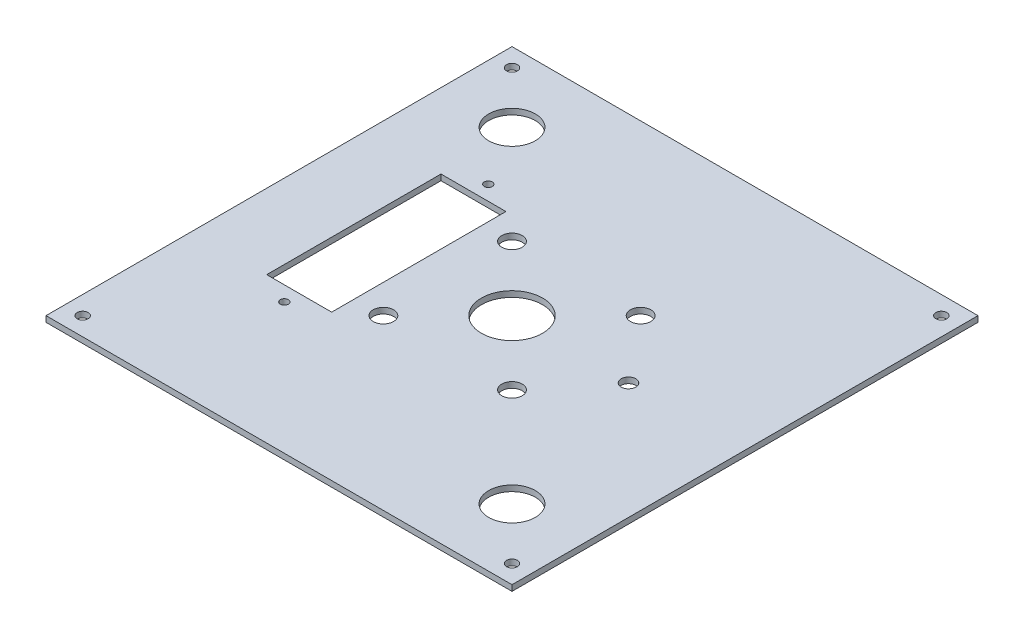
from build123d import *

# Parameters (mm, degrees)
SKETCH1_W           = 254
SKETCH1_H           = 254
BOSS_EXTRUDE1_DEPTH = 3.175
SKETCH5_W           = 35.405687869
SKETCH5_H           = 94.996
CUT_EXTRUDE4_DEPTH  = 25.4
SKETCH2_R           = 2.97688
CUT_EXTRUDE1_DEPTH  = 3.175
SKETCH3_R           = 5.55625
CUT_EXTRUDE3_DEPTH  = 3.175
SKETCH6_R           = 12.7
CUT_EXTRUDE5_DEPTH  = 3.175
SKETCH7_R           = 16.66875
CUT_EXTRUDE6_DEPTH  = 508
SKETCH8_R           = 2.1844
CUT_EXTRUDE7_DEPTH  = 3.175
SKETCH9_R           = 3.96875
CUT_EXTRUDE8_DEPTH  = 3.175


with BuildPart() as part:
    # Sketch1 → Boss-Extrude1 (new body)
    with BuildSketch(Plane(origin=(0, 0, 0), x_dir=(1, 0, 0), z_dir=(0, 1, 0))):
        Rectangle(SKETCH1_W, SKETCH1_H)
    extrude(amount=BOSS_EXTRUDE1_DEPTH)

    # Sketch5 → Cut-Extrude4 (cut)
    with BuildSketch(Plane(origin=(0, 3.175, 0), x_dir=(1, 0, 0), z_dir=(0, 1, 0))):
        with Locations((-68.502843935, 0)):
            Rectangle(SKETCH5_W, SKETCH5_H)
    extrude(amount=-CUT_EXTRUDE4_DEPTH, mode=Mode.SUBTRACT)

    # Sketch2 → Cut-Extrude1 (cut)
    with BuildSketch(Plane(origin=(0, 3.175, 0), x_dir=(1, 0, 0), z_dir=(0, 1, 0))):
        with Locations(Location((-117, 117, 0), (0, 0, 270))):
            Circle(SKETCH2_R)
        with Locations(Location((117, 117, 0), (0, 0, 270))):
            Circle(SKETCH2_R)
        with Locations(Location((117, -117, 0), (0, 0, 270))):
            Circle(SKETCH2_R)
        with Locations(Location((-117, -117, 0), (0, 0, 270))):
            Circle(SKETCH2_R)
    extrude(amount=-CUT_EXTRUDE1_DEPTH, mode=Mode.SUBTRACT)

    # Sketch3 → Cut-Extrude3 (cut)
    with BuildSketch(Plane(origin=(0, 3.175, 0), x_dir=(1, 0, 0), z_dir=(0, 1, 0))):
        with Locations(Location((-35.052, 35.052, 0), (0, 0, 270))):
            Circle(SKETCH3_R)
        with Locations(Location((35.052, 35.052, 0), (0, 0, 90))):
            Circle(SKETCH3_R)
        with Locations(Location((35.052, -35.052, 0), (0, 0, 270))):
            Circle(SKETCH3_R)
        with Locations(Location((-35.052, -35.052, 0), (0, 0, 90))):
            Circle(SKETCH3_R)
    extrude(amount=-CUT_EXTRUDE3_DEPTH, mode=Mode.SUBTRACT)

    # Sketch6 → Cut-Extrude5 (cut)
    with BuildSketch(Plane(origin=(0, 3.175, 0), x_dir=(1, 0, 0), z_dir=(0, 1, 0))):
        with Locations(Location((-88.9, 88.9, 0), (0, 0, 270))):
            Circle(SKETCH6_R)
        with Locations(Location((88.9, -88.9, 0), (0, 0, 90))):
            Circle(SKETCH6_R)
    extrude(amount=-CUT_EXTRUDE5_DEPTH, mode=Mode.SUBTRACT)

    # Sketch7 → Cut-Extrude6 (cut)
    with BuildSketch(Plane(origin=(0, 3.175, 0), x_dir=(1, 0, 0), z_dir=(0, 1, 0))):
        with Locations(Location((0, 0, 0), (0, 0, 270))):
            Circle(SKETCH7_R)
    extrude(amount=-CUT_EXTRUDE6_DEPTH, mode=Mode.SUBTRACT)

    # Sketch8 → Cut-Extrude7 (cut)
    with BuildSketch(Plane(origin=(0, 3.175, 0), x_dir=(1, 0, 0), z_dir=(0, 1, 0))):
        with Locations(Location((-68.502843935, 55.5625, 0), (0, 0, 270))):
            Circle(SKETCH8_R)
        with Locations(Location((-68.502843935, -55.5625, 0), (0, 0, 90))):
            Circle(SKETCH8_R)
    extrude(amount=-CUT_EXTRUDE7_DEPTH, mode=Mode.SUBTRACT)

    # Sketch9 → Cut-Extrude8 (cut)
    with BuildSketch(Plane(origin=(0, 3.175, 0), x_dir=(1, 0, 0), z_dir=(0, 1, 0))):
        with Locations(Location((63.5, 0, 0), (0, 0, 270))):
            Circle(SKETCH9_R)
    extrude(amount=-CUT_EXTRUDE8_DEPTH, mode=Mode.SUBTRACT)


solid = part.part
